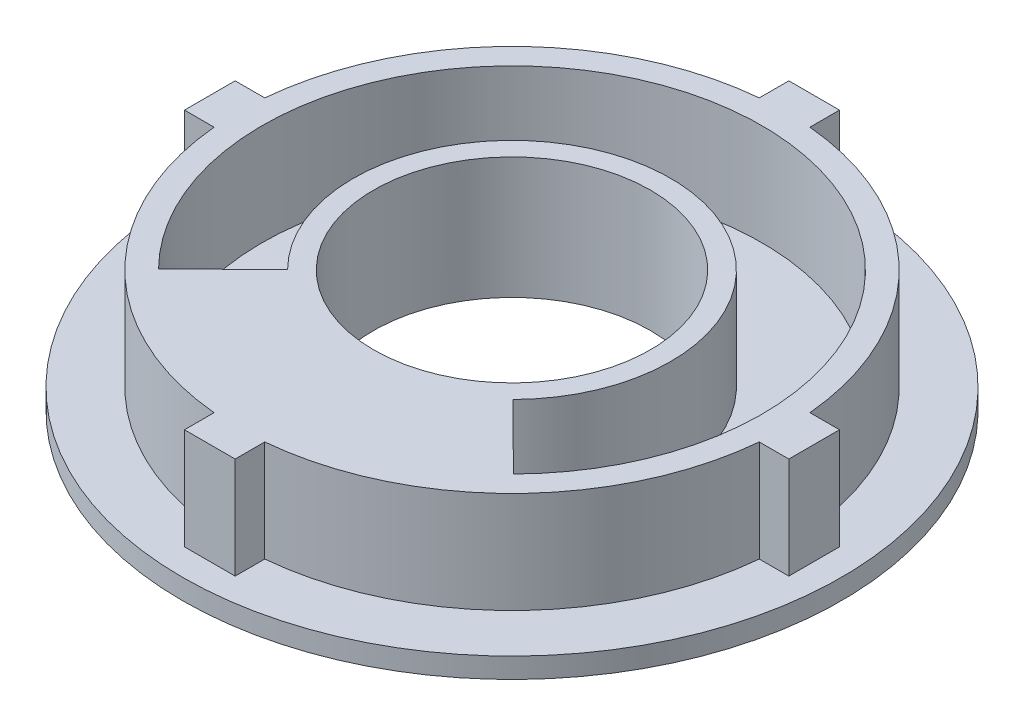
from build123d import *
from build123d.topology import SkipClean

# Parameters (mm, degrees)
SKETCH1_R           = 27
SKETCH1_R_2         = 13.65
BOSS_EXTRUDE1_DEPTH = 10
BOSS_EXTRUDE2_START = 2
SKETCH2_R           = 32.5
SKETCH2_R_2         = 13.65
BOSS_EXTRUDE2_DEPTH = 2
SKETCH3_W           = 5
SKETCH3_H           = 4.39677325
SKETCH3_W_2         = 4.39677325
SKETCH3_H_2         = 5
BOSS_EXTRUDE3_DEPTH = 10


with BuildPart() as part:
    # Sketch1 → Boss-Extrude1 (new body)
    with BuildSketch(Plane(origin=(0, 0, 0), x_dir=(1, 0, 0), z_dir=(0, 1, 0))):
        with Locations(Location((0, 0, 0), (0, 0, 270))):
            Circle(SKETCH1_R)
        with Locations(Location((0, 0, 0), (0, 0, 270))):
            Circle(SKETCH1_R_2, mode=Mode.SUBTRACT)
        with BuildLine():
            Line((-17.5, -17.360083525), (-11.110547667, -11.021716315))
            ThreePointArc((-11.110547667, -11.021716315), (0, 15.65), (11.110547667, -11.021716315))
            Line((11.110547667, -11.021716315), (17.5, -17.360083525))
            ThreePointArc((17.5, -17.360083525), (0, 24.65), (-17.5, -17.360083525))
        make_face(mode=Mode.SUBTRACT)
    extrude(amount=BOSS_EXTRUDE1_DEPTH)

    # Sketch2 → Boss-Extrude2 (add)
    with SkipClean():  # the faces are left unmerged after this step: merging them gives an invalid solid
        with BuildSketch(Plane.XZ.offset(BOSS_EXTRUDE2_START)):
            with Locations(Location((0, 0, 0), (0, 0, 270))):
                Circle(SKETCH2_R)
            with Locations(Location((0, 0, 0), (0, 0, 270))):
                Circle(SKETCH2_R_2, mode=Mode.SUBTRACT)
        extrude(amount=-BOSS_EXTRUDE2_DEPTH)

    # Sketch3 → Boss-Extrude3 (add)
    with SkipClean():  # the faces are left unmerged after this step: merging them gives an invalid solid
        with BuildSketch(Plane(origin=(0, 0, 0), x_dir=(1, 0, 0), z_dir=(0, 1, 0))):
            with Locations((0, 27.601613375)):
                Rectangle(SKETCH3_W, SKETCH3_H)
            with Locations((27.601613375, 0)):
                Rectangle(SKETCH3_W_2, SKETCH3_H_2)
            with Locations((0, -27.601613375)):
                Rectangle(SKETCH3_W, SKETCH3_H)
            with Locations((-27.601613375, 0)):
                Rectangle(SKETCH3_W_2, SKETCH3_H_2)
        extrude(amount=BOSS_EXTRUDE3_DEPTH)


solid = part.part
